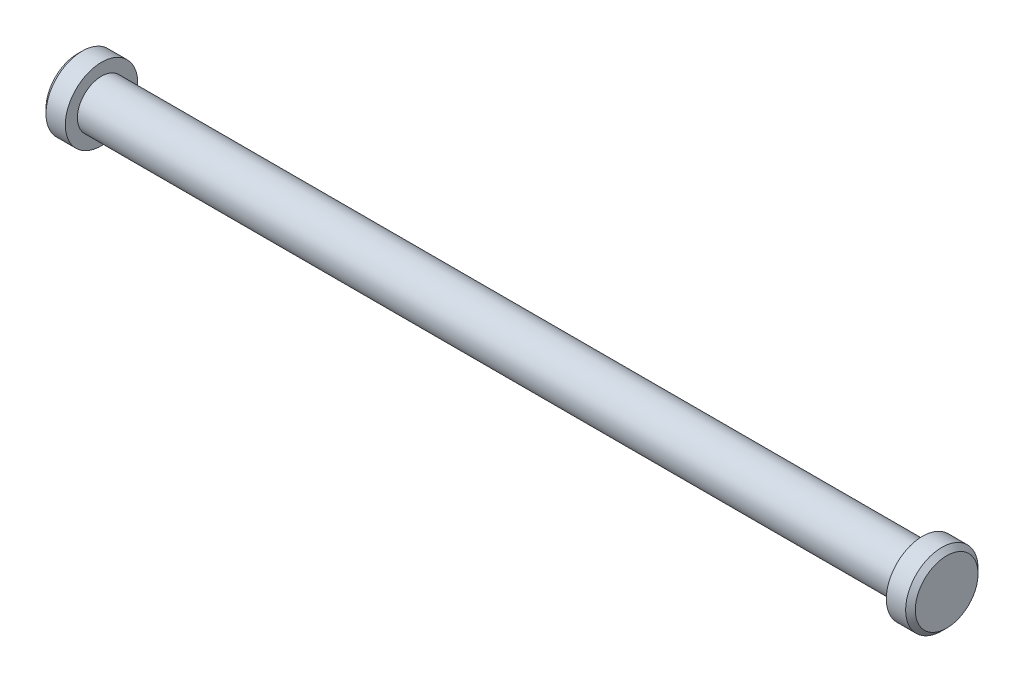
from build123d import *

# Parameters (mm, degrees)
CHAMFER1_SIZE = 0.254
SCALE1_SCALE  = 1.5


with BuildPart() as part:
    # Sketch1 → Revolve1 (revolve)
    with BuildSketch(Plane.XY, mode=Mode.PRIVATE) as revolve1_sk:
        Polygon((-22.86, 0), (-22.86, 1.905), (-21.59, 1.905), (-21.59, 1.27), (21.59, 1.27), (21.59, 1.905), (22.86, 1.905), (22.86, 0), align=None)
    revolve(revolve1_sk.sketch.rotate(Axis((-22.86, 0, 0), (1, 0, 0)), 90), axis=Axis((-22.86, 0, 0), (1, 0, 0)))

    # Chamfer1
    chamfer1_edges = [part.edges().sort_by_distance(p)[0] for p in [
        (22.86, 0, -1.905),
        (-22.86, 0, -1.905),
    ]]
    chamfer(chamfer1_edges, length=CHAMFER1_SIZE)


with BuildPart() as part_1:
    # Scale1: scaled about (0, 0, 0)
    add(part.part.scale(SCALE1_SCALE))


solid = part_1.part
